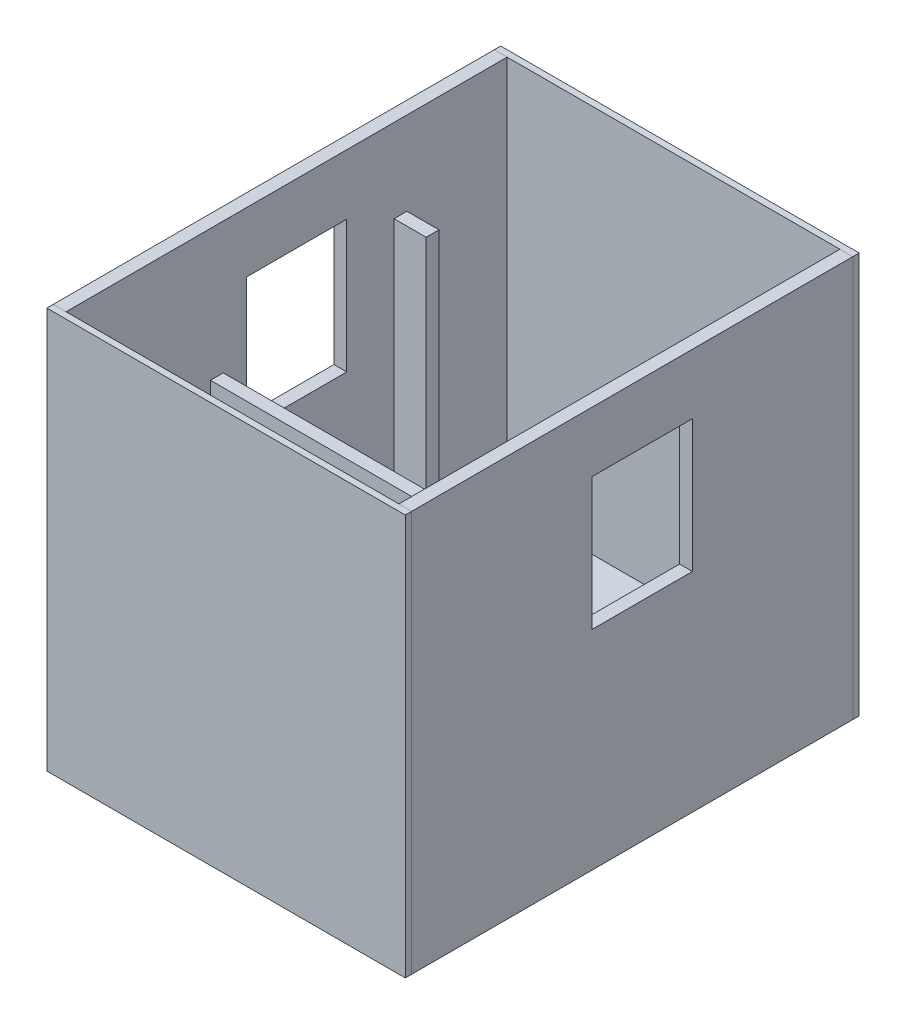
from build123d import *

# Parameters (mm, degrees)
ESQUISSE1_W             = 415
ESQUISSE1_H             = 550
BOSS_EXTRU_1_DEPTH      = 16
BOSS_EXTRU_2_START      = 40
ESQUISSE2_W             = 13
ESQUISSE2_H             = 27
BOSS_EXTRU_2_DEPTH      = 335
BOSS_EXTRU_2_2_DEPTH    = 335
ESQUISSE3_W             = 16
ESQUISSE3_H             = 550
BOSS_EXTRU_3_DEPTH      = 500
BOSS_EXTRU_3_2_DEPTH    = 500
ESQUISSE4_W             = 125
ESQUISSE4_H             = 165
ENL_V_MAT_EXTRU_1_DEPTH = 868.357481088
ESQUISSE5_W             = 415
ESQUISSE5_H             = 16
BOSS_EXTRU_4_DEPTH      = 320
ESQUISSE6_W             = 447
ESQUISSE6_H             = 500
BOSS_EXTRU_5_DEPTH      = 8
ESQUISSE7_W             = 447
ESQUISSE7_H             = 500
BOSS_EXTRU_6_DEPTH      = 8
ESQUISSE9_W             = 40
ESQUISSE9_H             = 16
BOSS_EXTRU_8_DEPTH      = 380
BOSS_EXTRU_8_2_DEPTH    = 380
ESQUISSE10_W            = 16
ESQUISSE10_H            = 180
BOSS_EXTRU_9_DEPTH      = 180


with BuildPart() as part:
    # Esquisse1 → Boss.-Extru.1 (new body)
    with BuildSketch(Plane(origin=(0, 0, 0), x_dir=(1, 0, 0), z_dir=(0, 1, 0))):
        with Locations((207.5, 275)):
            Rectangle(ESQUISSE1_W, ESQUISSE1_H)
    extrude(amount=BOSS_EXTRU_1_DEPTH)


with BuildPart() as body_2:
    # Esquisse2 → Boss.-Extru.2 (new body)
    with BuildSketch(Plane(origin=(0, 0, -500), x_dir=(0, 0, -1), z_dir=(1, 0, 0)).offset(BOSS_EXTRU_2_START)):
        with Locations((-188.5, 29.5)):
            Rectangle(ESQUISSE2_W, ESQUISSE2_H)
    extrude(amount=BOSS_EXTRU_2_DEPTH)


with BuildPart() as body_3:
    # Esquisse2 → Boss.-Extru.2 2 (new body)
    with BuildSketch(Plane(origin=(0, 0, -500), x_dir=(0, 0, -1), z_dir=(1, 0, 0)).offset(BOSS_EXTRU_2_START)):
        with Locations((-81.5, 29.5)):
            Rectangle(ESQUISSE2_W, ESQUISSE2_H)
    extrude(amount=BOSS_EXTRU_2_2_DEPTH)


with BuildPart() as body_4:
    # Esquisse3 → Boss.-Extru.3 (new body)
    with BuildSketch(Plane(origin=(0, 0, 0), x_dir=(1, 0, 0), z_dir=(0, 1, 0))):
        with Locations((-8, 275)):
            Rectangle(ESQUISSE3_W, ESQUISSE3_H)
    extrude(amount=BOSS_EXTRU_3_DEPTH)


with BuildPart() as body_5:
    # Esquisse3 → Boss.-Extru.3 2 (new body)
    with BuildSketch(Plane(origin=(0, 0, 0), x_dir=(1, 0, 0), z_dir=(0, 1, 0))):
        with Locations((423, 275)):
            Rectangle(ESQUISSE3_W, ESQUISSE3_H)
    extrude(amount=BOSS_EXTRU_3_2_DEPTH)


with BuildPart() as enl_v_mat_extru_1_tool:
    # Esquisse4 → Enlèv. mat.-Extru.1 (new, through all)
    with BuildSketch(Plane.ZY.offset(16)):
        with Locations((-287.5, 342.5)):
            Rectangle(ESQUISSE4_W, ESQUISSE4_H)
    extrude(amount=-ENL_V_MAT_EXTRU_1_DEPTH)


with BuildPart() as body_4_1:
    add(body_4.part)

    # Enlèv. mat.-Extru.1: cut by enl_v_mat_extru_1_tool
    add(enl_v_mat_extru_1_tool.part, mode=Mode.SUBTRACT)


with BuildPart() as body_5_1:
    add(body_5.part)

    # Enlèv. mat.-Extru.1: cut by enl_v_mat_extru_1_tool
    add(enl_v_mat_extru_1_tool.part, mode=Mode.SUBTRACT)


with BuildPart() as body_6:
    # Esquisse5 → Boss.-Extru.4 (new body)
    with BuildSketch(Plane(origin=(0, 16, 0), x_dir=(1, 0, 0), z_dir=(0, 1, 0))):
        with Locations((207.5, 188)):
            Rectangle(ESQUISSE5_W, ESQUISSE5_H)
    extrude(amount=BOSS_EXTRU_4_DEPTH)


with BuildPart() as body_7:
    # Esquisse6 → Boss.-Extru.5 (new body)
    with BuildSketch(Plane(origin=(0, 0, -550), x_dir=(-1, 0, 0), z_dir=(0, 0, -1))):
        with Locations((-207.5, 250)):
            Rectangle(ESQUISSE6_W, ESQUISSE6_H)
    extrude(amount=BOSS_EXTRU_5_DEPTH)


with BuildPart() as body_8:
    # Esquisse7 → Boss.-Extru.6 (new body)
    with BuildSketch(Plane.XY):
        with Locations((207.5, 250)):
            Rectangle(ESQUISSE7_W, ESQUISSE7_H)
    extrude(amount=BOSS_EXTRU_6_DEPTH)


with BuildPart() as body_9:
    # Esquisse9 → Boss.-Extru.8 (new body)
    with BuildSketch(Plane(origin=(0, 16, 0), x_dir=(1, 0, 0), z_dir=(0, 1, 0))):
        with Locations((20, 417)):
            Rectangle(ESQUISSE9_W, ESQUISSE9_H)
    extrude(amount=BOSS_EXTRU_8_DEPTH)


with BuildPart() as body_10:
    # Esquisse9 → Boss.-Extru.8 2 (new body)
    with BuildSketch(Plane(origin=(0, 16, 0), x_dir=(1, 0, 0), z_dir=(0, 1, 0))):
        with Locations((395, 417)):
            Rectangle(ESQUISSE9_W, ESQUISSE9_H)
    extrude(amount=BOSS_EXTRU_8_2_DEPTH)


with BuildPart() as body_11:
    # Esquisse10 → Boss.-Extru.9 (new body)
    with BuildSketch(Plane(origin=(0, 16, 0), x_dir=(1, 0, 0), z_dir=(0, 1, 0))):
        with Locations((293, 90)):
            Rectangle(ESQUISSE10_W, ESQUISSE10_H)
    extrude(amount=BOSS_EXTRU_9_DEPTH)


solid = Compound([part.part, body_2.part, body_3.part, body_4_1.part, body_5_1.part, body_6.part, body_7.part, body_8.part, body_9.part, body_10.part, body_11.part])
